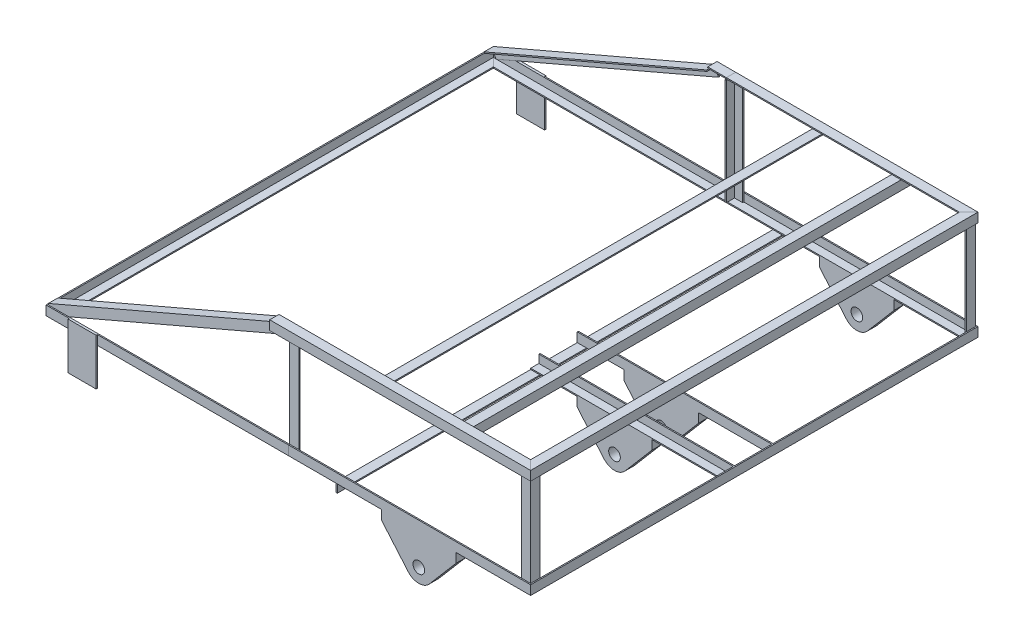
from build123d import *

# Parameters (mm, degrees)
BOSS_EXTRUDE4_DEPTH  = 144.4625
BOSS_EXTRUDE5_REACH  = 709.466
BOSS_EXTRUDE6_START  = 304.8
SKETCH8_R            = 7.9375
BOSS_EXTRUDE6_DEPTH  = 12.7
BOSS_EXTRUDE11_START = -12.7
SKETCH11_R           = 7.9375
BOSS_EXTRUDE11_DEPTH = 12.7
BOSS_EXTRUDE12_REACH = 521.326
BOSS_EXTRUDE15_START = -12.7
SKETCH13_R           = 7.9375
BOSS_EXTRUDE15_DEPTH = 12.7
SKETCH14_R           = 7.9375
BOSS_EXTRUDE16_DEPTH = 12.7
SKETCH15_W           = 38.1
SKETCH15_H           = 1.5875
BOSS_EXTRUDE17_DEPTH = 63.5
CUT_EXTRUDE1_REACH   = 712.196
SKETCH18_W           = 304.8
SKETCH18_H           = 12.7
BOSS_EXTRUDE21_DEPTH = 1.5875
BOSS_EXTRUDE23_DEPTH = 12.7


with BuildPart() as part:
    # Sweep1: sweep along a path in Sketch1
    with BuildLine(Plane(origin=(0, 0, 0), x_dir=(1, 0, 0), z_dir=(0, 1, 0))) as sweep1_path:
        Line((-330.2, -304.8), (330.2, -304.8))
        Line((330.2, -304.8), (330.2, 304.8))
        Line((330.2, 304.8), (-330.2, 304.8))
        Line((-330.2, 304.8), (-330.2, -304.8))
    # Sketch2 → Sweep1 (sweep)
    with BuildSketch(Plane(origin=(0, 0, 0), x_dir=(0, 0, -1), z_dir=(1, 0, 0))):
        Polygon((-304.8, 0), (-292.1, 0), (-292.1, 1.5875), (-303.2125, 1.5875), (-303.2125, 12.7), (-304.8, 12.7), align=None)
    sweep(path=sweep1_path.line, transition=Transition.RIGHT)



with BuildPart() as body_2:
    # Sweep2: sweep along a path in Sketch4
    with BuildLine(Plane(origin=(0, 147.6375, 0), x_dir=(1, 0, 0), z_dir=(0, 1, 0))) as sweep2_path:
        Line((-330.2, -304.8), (330.2, -304.8))
        Line((330.2, -304.8), (330.2, 304.8))
        Line((330.2, 304.8), (-330.2, 304.8))
        Line((-330.2, 304.8), (-330.2, -304.8))
    # Sketch5 → Sweep2 (sweep)
    with BuildSketch(Plane(origin=(0, 0, 0), x_dir=(0, 0, -1), z_dir=(1, 0, 0))):
        Polygon((304.8, 147.6375), (304.8, 134.9375), (303.2125, 134.9375), (303.2125, 146.05), (292.1, 146.05), (292.1, 147.6375), align=None)
    sweep(path=sweep2_path.line, transition=Transition.RIGHT)


with BuildPart() as part_1:
    add(part.part)

    add(body_2.part)  # Boss-Extrude4 merges body 2
    # Sketch6 → Boss-Extrude4 (add)
    with BuildSketch(Plane(origin=(0, 1.5875, 0), x_dir=(1, 0, 0), z_dir=(0, 1, 0))):
        Polygon((315.9125, -303.2125), (328.6125, -303.2125), (328.6125, -290.5125), (327.025, -290.5125), (327.025, -301.625), (315.9125, -301.625), align=None)
        Polygon((12.7, -303.2125), (12.7, -301.625), (1.5875, -301.625), (1.5875, -290.5125), (0, -290.5125), (0, -303.2125), align=None)
    boss_extrude4 = extrude(amount=BOSS_EXTRUDE4_DEPTH)

    # Mirror1: Boss-Extrude4 across plane
    add(boss_extrude4.mirror(Plane.XY))

    # Boss-Extrude5: up to this face of the body (flat: up to its plane)
    boss_extrude5_end = Plane(part_1.part.faces().sort_by_distance((-164.30625, 140.49375, -303.2125))[0])
    # Sketch7 → Boss-Extrude5 (add, up to the picked face)
    with BuildSketch(Plane(origin=(0, 0, 303.2125), x_dir=(-1, 0, 0), z_dir=(0, 0, -1)), mode=Mode.PRIVATE) as boss_extrude5_sk1:
        Polygon((-238.125, 146.05), (-238.125, 133.35), (-236.5375, 133.35), (-236.5375, 144.4625), (-225.425, 144.4625), (-225.425, 146.05), align=None)
    boss_extrude5_tool1 = split(extrude(boss_extrude5_sk1.sketch, amount=BOSS_EXTRUDE5_REACH, mode=Mode.PRIVATE), bisect_by=boss_extrude5_end, keep=Keep.BOTH, mode=Mode.PRIVATE)
    # Sketch7 → Boss-Extrude5 (add, up to the picked face)
    with BuildSketch(Plane(origin=(0, 0, 303.2125), x_dir=(-1, 0, 0), z_dir=(0, 0, -1)), mode=Mode.PRIVATE) as boss_extrude5_sk2:
        Polygon((-130.175, 146.05), (-117.475, 146.05), (-117.475, 133.35), (-119.0625, 133.35), (-119.0625, 144.4625), (-130.175, 144.4625), align=None)
    boss_extrude5_tool2 = split(extrude(boss_extrude5_sk2.sketch, amount=BOSS_EXTRUDE5_REACH, mode=Mode.PRIVATE), bisect_by=boss_extrude5_end, keep=Keep.BOTH, mode=Mode.PRIVATE)
    # Sketch7 → Boss-Extrude5 (add, up to the picked face)
    with BuildSketch(Plane(origin=(0, 0, 303.2125), x_dir=(-1, 0, 0), z_dir=(0, 0, -1)), mode=Mode.PRIVATE) as boss_extrude5_sk3:
        Polygon((-76.2, 0), (-76.2, -1.5875), (-65.0875, -1.5875), (-65.0875, -12.7), (-63.5, -12.7), (-63.5, 0), align=None)
    boss_extrude5_tool3 = split(extrude(boss_extrude5_sk3.sketch, amount=BOSS_EXTRUDE5_REACH, mode=Mode.PRIVATE), bisect_by=boss_extrude5_end, keep=Keep.BOTH, mode=Mode.PRIVATE)
    add(boss_extrude5_tool1.solids().sort_by(Axis((237.945395, 139.7, 303.2125), (0, 0, -1)))[0])
    add(boss_extrude5_tool2.solids().sort_by(Axis((123.825, 145.870395, 303.2125), (0, 0, -1)))[0])
    add(boss_extrude5_tool3.solids().sort_by(Axis((76.020395, -0.79375, 303.2125), (0, 0, -1)))[0])

    # Sketch8 → Boss-Extrude6 (add)
    with BuildSketch(Plane.XY.offset(BOSS_EXTRUDE6_START)):
        with BuildLine():
            Line((127, -12.7), (127, 0))
            Line((127, 0), (228.6, 0))
            Line((228.6, 0), (228.6, -12.7))
            Line((228.6, -12.7), (192.288023852, -55.23180333))
            ThreePointArc((192.288023852, -55.23180333), (177.8, -61.9125), (163.311976148, -55.23180333))
            Line((163.311976148, -55.23180333), (127, -12.7))
        make_face()
        with Locations((177.8, -42.8625)):
            Circle(SKETCH8_R, mode=Mode.SUBTRACT)
    extrude(amount=-BOSS_EXTRUDE6_DEPTH)

    # Sketch11 → Boss-Extrude11 (add)
    with BuildSketch(Plane(origin=(0, 0, -304.8), x_dir=(-1, 0, 0), z_dir=(0, 0, -1)).offset(BOSS_EXTRUDE11_START)):
        with BuildLine():
            Line((-127, -12.7), (-127, 0))
            Line((-127, 0), (-228.6, 0))
            Line((-228.6, 0), (-228.6, -12.7))
            Line((-228.6, -12.7), (-192.288023852, -55.23180333))
            ThreePointArc((-192.288023852, -55.23180333), (-177.8, -61.9125), (-163.311976148, -55.23180333))
            Line((-163.311976148, -55.23180333), (-127, -12.7))
        make_face()
        with Locations(Location((-177.8, -42.8625, 0), (0, 0, 180))):
            Circle(SKETCH11_R, mode=Mode.SUBTRACT)
    extrude(amount=BOSS_EXTRUDE11_DEPTH)

    # Boss-Extrude12: up to this face of the body (flat: up to its plane)
    boss_extrude12_end = Plane(part_1.part.faces().sort_by_distance((328.6125, 7.14375, 0))[0])
    # Sketch12 → Boss-Extrude12 (add, up to the picked face)
    with BuildSketch(Plane.ZY.offset(-63.5), mode=Mode.PRIVATE) as boss_extrude12_sk1:
        Polygon((-25.4, 0), (-25.4, 12.7), (-26.9875, 12.7), (-26.9875, 1.5875), (-38.1, 1.5875), (-38.1, 0), align=None)
    boss_extrude12_tool1 = split(extrude(boss_extrude12_sk1.sketch, amount=-BOSS_EXTRUDE12_REACH, mode=Mode.PRIVATE), bisect_by=boss_extrude12_end, keep=Keep.BOTH, mode=Mode.PRIVATE)
    # Sketch12 → Boss-Extrude12 (add, up to the picked face)
    with BuildSketch(Plane.ZY.offset(-63.5), mode=Mode.PRIVATE) as boss_extrude12_sk2:
        Polygon((25.4, 0), (25.4, 12.7), (26.9875, 12.7), (26.9875, 1.5875), (38.1, 1.5875), (38.1, 0), align=None)
    boss_extrude12_tool2 = split(extrude(boss_extrude12_sk2.sketch, amount=-BOSS_EXTRUDE12_REACH, mode=Mode.PRIVATE), bisect_by=boss_extrude12_end, keep=Keep.BOTH, mode=Mode.PRIVATE)
    add(boss_extrude12_tool1.solids().sort_by(Axis((63.5, 6.35, -25.579605), (1, 0, 0)))[0])
    add(boss_extrude12_tool2.solids().sort_by(Axis((63.5, 6.35, 25.579605), (1, 0, 0)))[0])

    # Sketch13 → Boss-Extrude15 (add)
    with BuildSketch(Plane(origin=(0, 0, -38.1), x_dir=(-1, 0, 0), z_dir=(0, 0, -1)).offset(BOSS_EXTRUDE15_START)):
        with BuildLine():
            Line((-127, 0), (-228.6, 0))
            Line((-228.6, 0), (-228.6, -12.7))
            Line((-228.6, -12.7), (-192.288023852, -55.23180333))
            ThreePointArc((-192.288023852, -55.23180333), (-177.8, -61.9125), (-163.311976148, -55.23180333))
            Line((-163.311976148, -55.23180333), (-127, -12.7))
            Line((-127, -12.7), (-127, 0))
        make_face()
        with Locations(Location((-177.8, -42.8625, 0), (0, 0, 180))):
            Circle(SKETCH13_R, mode=Mode.SUBTRACT)
    extrude(amount=BOSS_EXTRUDE15_DEPTH)

    # Sketch14 → Boss-Extrude16 (add)
    with BuildSketch(Plane.XY.offset(38.1)):
        with BuildLine():
            Line((228.6, -12.7), (228.6, 0))
            Line((228.6, 0), (127, 0))
            Line((127, 0), (127, -12.7))
            Line((127, -12.7), (163.311976148, -55.23180333))
            ThreePointArc((163.311976148, -55.23180333), (177.8, -61.9125), (192.288023852, -55.23180333))
            Line((192.288023852, -55.23180333), (228.6, -12.7))
        make_face()
        with Locations((177.8, -42.8625)):
            Circle(SKETCH14_R, mode=Mode.SUBTRACT)
    extrude(amount=-BOSS_EXTRUDE16_DEPTH)

    # Sketch15 → Boss-Extrude17 (add)
    with BuildSketch(Plane(origin=(0, 12.7, 0), x_dir=(1, 0, 0), z_dir=(0, 1, 0))):
        with Locations((-279.4, 305.59375)):
            Rectangle(SKETCH15_W, SKETCH15_H)
        with Locations((-279.4, -305.59375)):
            Rectangle(SKETCH15_W, SKETCH15_H)
    extrude(amount=-BOSS_EXTRUDE17_DEPTH)

    # Cut-Extrude1: up to this face of the body (flat: up to its plane)
    cut_extrude1_end = Plane(part_1.part.faces().sort_by_distance((0, 141.2875, 304.8))[0])
    # Sketch18 → Cut-Extrude1 (cut, up to the picked face)
    with BuildSketch(Plane(origin=(0, 0, -304.8), x_dir=(-1, 0, 0), z_dir=(0, 0, -1)), mode=Mode.PRIVATE) as cut_extrude1_sk1:
        with Locations((177.8, 141.2875)):
            Rectangle(SKETCH18_W, SKETCH18_H)
    cut_extrude1_tool1 = split(extrude(cut_extrude1_sk1.sketch, amount=-CUT_EXTRUDE1_REACH, mode=Mode.PRIVATE), bisect_by=cut_extrude1_end, keep=Keep.BOTH, mode=Mode.PRIVATE)
    add(cut_extrude1_tool1.solids().sort_by(Axis((-177.8, 141.2875, -304.8), (0, 0, 1)))[0], mode=Mode.SUBTRACT)

    # Sketch19 → Boss-Extrude21 (add)
    with BuildSketch(Plane.XY.offset(-303.2125)):
        Polygon((-25.4, 144.78), (-328.6125, 14.526382188), (-323.599797289, 2.8575), (-20.387297289, 133.111117812), align=None)
    boss_extrude21 = extrude(amount=BOSS_EXTRUDE21_DEPTH)

    # Sketch20 → Boss-Extrude23 (add)
    with BuildSketch(Plane(origin=(0, 0, -303.2125), x_dir=(-1, 0, 0), z_dir=(0, 0, -1))):
        Polygon((25.4, 144.78), (328.6125, 14.526382188), (327.985912161, 13.067771915), (24.773412161, 143.321389726), align=None)
    boss_extrude23 = extrude(amount=-BOSS_EXTRUDE23_DEPTH)

    # Mirror2: Boss-Extrude21, Boss-Extrude23 across plane
    add(boss_extrude21.mirror(Plane.XY))
    add(boss_extrude23.mirror(Plane.XY))


solid = part_1.part
